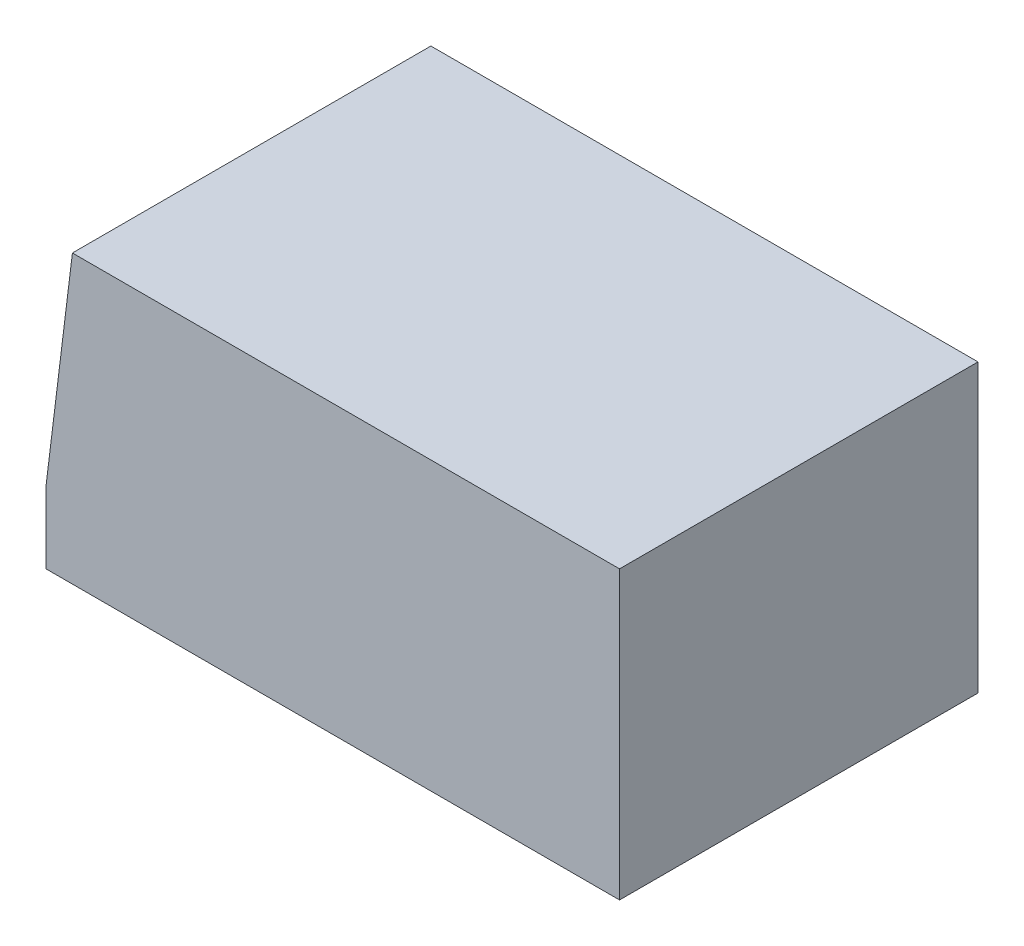
from build123d import *

# Parameters (mm, degrees)
ESQUISSE1_W             = 80
ESQUISSE1_H             = 50
BOSS_EXTRU_1_DEPTH      = 40
CHANFREIN1_SIZE         = 30
CHANFREIN1_SIZE2        = 3.683536827
ESQUISSE2_R             = 12.5
ENL_V_MAT_EXTRU_1_DEPTH = 40


with BuildPart() as part:
    # Esquisse1 → Boss.-Extru.1 (new body)
    with BuildSketch(Plane(origin=(0, 0, 0), x_dir=(1, 0, 0), z_dir=(0, 1, 0))):
        Rectangle(ESQUISSE1_W, ESQUISSE1_H)
    extrude(amount=BOSS_EXTRU_1_DEPTH)

    # Chanfrein1
    chanfrein1_edges = [part.edges().sort_by_distance(p)[0] for p in [
        (-40, 40, 0),
    ]]
    chanfrein1_side = [part.faces().sort_by_distance(p)[0] for p in [
        (-40, 20, 0),
    ]]
    chamfer(chanfrein1_edges, length=CHANFREIN1_SIZE, length2=CHANFREIN1_SIZE2, reference=chanfrein1_side[0])

    # Esquisse2 → Enlèv. mat.-Extru.1 (cut)
    with BuildSketch(Plane(origin=(-40.615524004, 4.986959281, 0), x_dir=(0, 0, 1), z_dir=(-0.9925461516413225, 0.12186934340514435, 0))):
        with Locations(Location((0, 18.821046558, 0), (0, 0, 270))):
            Circle(ESQUISSE2_R)
    extrude(amount=-ENL_V_MAT_EXTRU_1_DEPTH, mode=Mode.SUBTRACT)


solid = part.part
